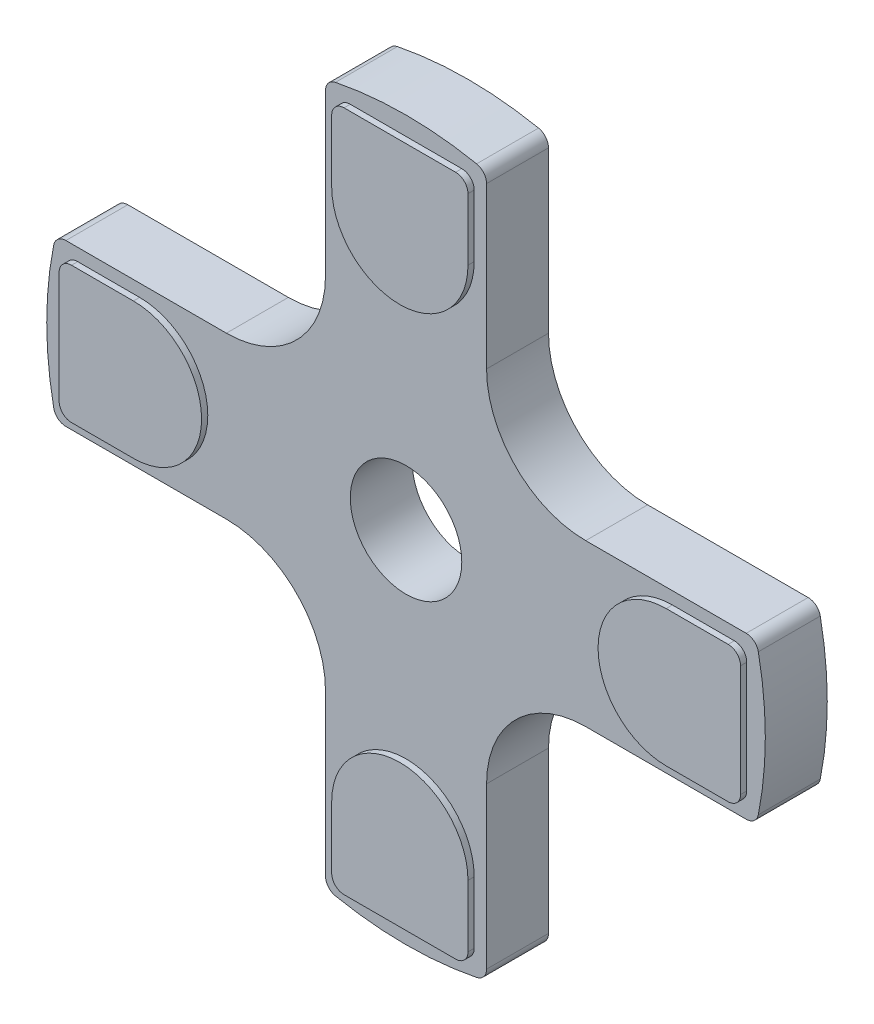
from build123d import *

# Parameters (mm, degrees)
SKETCH1_R                = 1.4732
SKETCH1_R_2              = 0.2286
BOSS_EXTRUDE1_DEPTH      = 0.254
CUT_EXTRUDE3_DEPTH       = 3.098845511
FILLET1_R                = 0.0508
CIRPATTERN2_COUNT        = 4
FILLET1_OF_CIRPATTERN2_R = 0.0508
BOSS_EXTRUDE2_DEPTH      = 0.0254
BOSS_EXTRUDE4_START      = 0.01778
BOSS_EXTRUDE4_DEPTH      = 0.01778
CIRPATTERN1_COUNT        = 4


with BuildPart() as part:
    # Sketch1 → Boss-Extrude1 (new body)
    with BuildSketch(Plane.XY):
        Circle(SKETCH1_R)
        Circle(SKETCH1_R_2, mode=Mode.SUBTRACT)
    extrude(amount=BOSS_EXTRUDE1_DEPTH)

    # Sketch11 → Cut-Extrude3 (cut, through all)
    with BuildSketch(Plane.XY):
        with BuildLine():
            Line((2.543481959, 0.3302), (0.7366, 0.3302))
            ThreePointArc((0.7366, 0.3302), (0.449231804, 0.449231804), (0.3302, 0.7366))
            Line((0.3302, 0.7366), (0.3302, 2.543481959))
            Line((0.3302, 2.543481959), (2.543481959, 0.3302))
        make_face()
    cut_extrude3 = extrude(amount=CUT_EXTRUDE3_DEPTH, mode=Mode.SUBTRACT)

    # Fillet1
    fillet1_edges = [part.edges().sort_by_distance(p)[0] for p in [
        (1.435718009, 0.3302, 0.127),
        (0.3302, 1.435718009, 0.127),
    ]]
    fillet(fillet1_edges, radius=FILLET1_R)

    # CirPattern2: Cut-Extrude3 ×4 about axis
    cirpattern2_axis = Axis((0, 0, -0.05461), (0, 0, 1))
    for i in range(1, CIRPATTERN2_COUNT):
        add(cut_extrude3.rotate(cirpattern2_axis, i * 360 / CIRPATTERN2_COUNT), mode=Mode.SUBTRACT)

    # Fillet1 of CirPattern2
    fillet1_of_cirpattern2_edges = [part.edges().sort_by_distance(p)[0] for p in [
        (-0.3302, 1.435718009, 0.127),
        (-1.435718009, 0.3302, 0.127),
        (-1.435718009, -0.3302, 0.127),
        (-0.3302, -1.435718009, 0.127),
        (0.3302, -1.435718009, 0.127),
        (1.435718009, -0.3302, 0.127),
    ]]
    fillet(fillet1_of_cirpattern2_edges, radius=FILLET1_OF_CIRPATTERN2_R)

    # Sketch2 → Boss-Extrude2 (add)
    with BuildSketch(Plane.XY.offset(0.254)):
        with BuildLine():
            Line((1.0922, 0.2794), (1.3462, 0.2794))
            ThreePointArc((1.3462, 0.2794), (1.382121024, 0.264521024), (1.397, 0.2286))
            Line((1.397, 0.2286), (1.397, -0.2286))
            ThreePointArc((1.397, -0.2286), (1.382121024, -0.264521024), (1.3462, -0.2794))
            Line((1.3462, -0.2794), (1.0922, -0.2794))
            ThreePointArc((1.0922, -0.2794), (0.8128, 0), (1.0922, 0.2794))
        make_face()
    boss_extrude2 = extrude(amount=BOSS_EXTRUDE2_DEPTH)

    # Sketch5 → Boss-Extrude4 (add)
    with BuildSketch(Plane(origin=(0, 0, 0), x_dir=(-1, 0, 0), z_dir=(0, 0, -1)).offset(BOSS_EXTRUDE4_START)):
        with BuildLine():
            Line((-1.397, 0.2286), (-1.397, -0.2286))
            ThreePointArc((-1.397, -0.2286), (-1.382121024, -0.264521024), (-1.3462, -0.2794))
            Line((-1.3462, -0.2794), (-1.0922, -0.2794))
            ThreePointArc((-1.0922, -0.2794), (-0.8128, 0), (-1.0922, 0.2794))
            Line((-1.0922, 0.2794), (-1.3462, 0.2794))
            ThreePointArc((-1.3462, 0.2794), (-1.382121024, 0.264521024), (-1.397, 0.2286))
        make_face()
    boss_extrude4 = extrude(amount=-BOSS_EXTRUDE4_DEPTH)

    # CirPattern1: Boss-Extrude2, Boss-Extrude4 ×4 about axis
    cirpattern1_axis = Axis((0, 0, -0.05461), (0, 0, 1))
    add([boss_extrude2.rotate(cirpattern1_axis, i * 360 / CIRPATTERN1_COUNT) for i in range(1, CIRPATTERN1_COUNT)])
    add([boss_extrude4.rotate(cirpattern1_axis, i * 360 / CIRPATTERN1_COUNT) for i in range(1, CIRPATTERN1_COUNT)])


solid = part.part
